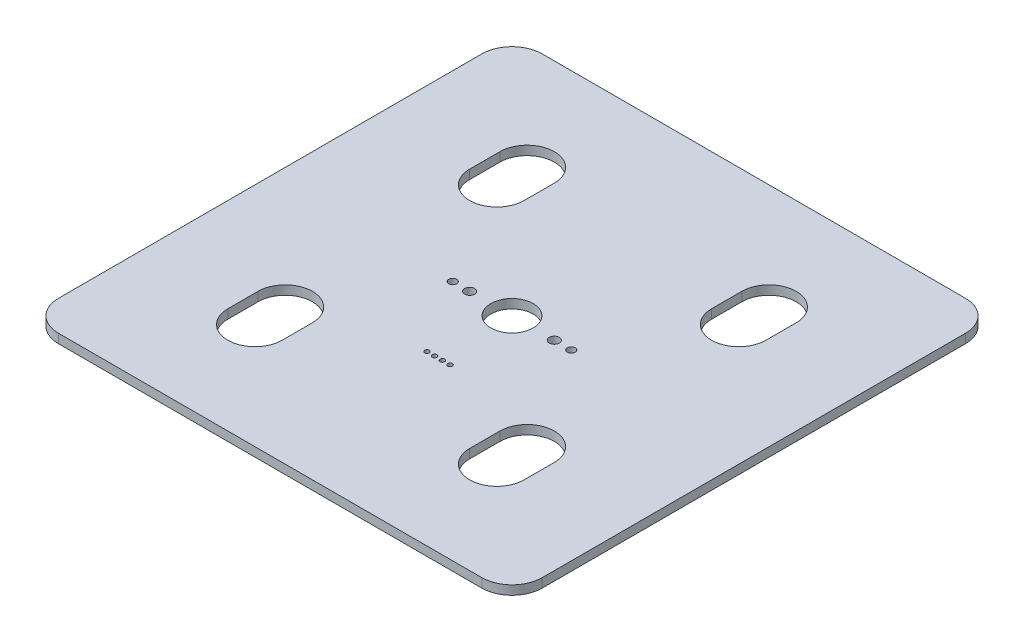
from build123d import *

# Parameters (mm, degrees)
SKETCH1_W               = 80
SKETCH1_H               = 80
BOSS_EXTRUDE1_DEPTH     = 0.75
FILLET1_R               = 5
FILLET3_R               = 5
FILLET4_R               = 5
FILLET5_R               = 5
CUT_EXTRUDE1_DEPTH      = 57.588426379
CUT_EXTRUDE1_DEPTH_BACK = 57.588426379
CUT_EXTRUDE2_DEPTH      = 57.588426379
CUT_EXTRUDE2_DEPTH_BACK = 57.588426379
SKETCH3_R               = 3.5
CUT_EXTRUDE3_DEPTH      = 57.588426379
CUT_EXTRUDE3_DEPTH_BACK = 57.588426379
SKETCH4_R               = 0.38
SKETCH4_R_2             = 0.65
SKETCH4_R_3             = 0.825


with BuildPart() as part:
    # Sketch1 → Boss-Extrude1 (new, symmetric)
    with BuildSketch(Plane(origin=(0, 0, 0), x_dir=(1, 0, 0), z_dir=(0, 1, 0))):
        Rectangle(SKETCH1_W, SKETCH1_H)
    extrude(amount=BOSS_EXTRUDE1_DEPTH, both=True)

    # Fillet1
    fillet1_edges = [part.edges().sort_by_distance(p)[0] for p in [
        (-40, 0, 40),
    ]]
    fillet(fillet1_edges, radius=FILLET1_R)

    # Fillet3
    fillet3_edges = [part.edges().sort_by_distance(p)[0] for p in [
        (-40, 0, -40),
    ]]
    fillet(fillet3_edges, radius=FILLET3_R)

    # Fillet4
    fillet4_edges = [part.edges().sort_by_distance(p)[0] for p in [
        (40, 0, -40),
    ]]
    fillet(fillet4_edges, radius=FILLET4_R)

    # Fillet5
    fillet5_edges = [part.edges().sort_by_distance(p)[0] for p in [
        (40, 0, 40),
    ]]
    fillet(fillet5_edges, radius=FILLET5_R)

    # Sketch2 → Cut-Extrude1 (cut, two sides: drawn at the far end of the back side and taken through both)
    with BuildSketch(Plane(origin=(0, 0.75, 0), x_dir=(1, 0, 0), z_dir=(0, 1, 0)).offset(-CUT_EXTRUDE1_DEPTH_BACK)):
        with BuildLine():
            Line((-24.5, 17.5), (-24.5, 22.5))
            ThreePointArc((-24.5, 22.5), (-20, 27), (-15.5, 22.5))
            Line((-15.5, 22.5), (-15.5, 17.5))
            ThreePointArc((-15.5, 17.5), (-20, 13), (-24.5, 17.5))
        make_face()
        with BuildLine():
            Line((-15.5, -17.5), (-15.5, -22.5))
            ThreePointArc((-15.5, -22.5), (-20, -27), (-24.5, -22.5))
            Line((-24.5, -22.5), (-24.5, -17.5))
            ThreePointArc((-24.5, -17.5), (-20, -13), (-15.5, -17.5))
        make_face()
        with BuildLine():
            Line((15.5, -17.5), (15.5, -22.5))
            ThreePointArc((15.5, -22.5), (20, -27), (24.5, -22.5))
            Line((24.5, -22.5), (24.5, -17.5))
            ThreePointArc((24.5, -17.5), (20, -13), (15.5, -17.5))
        make_face()
        with BuildLine():
            Line((24.5, 17.5), (24.5, 22.5))
            ThreePointArc((24.5, 22.5), (20, 27), (15.5, 22.5))
            Line((15.5, 22.5), (15.5, 17.5))
            ThreePointArc((15.5, 17.5), (20, 13), (24.5, 17.5))
        make_face()
    extrude(amount=CUT_EXTRUDE1_DEPTH + CUT_EXTRUDE1_DEPTH_BACK, mode=Mode.SUBTRACT)

    # Sketch3 → Cut-Extrude2 (cut, two sides: drawn at the far end of the back side and taken through both)
    with BuildSketch(Plane(origin=(0, 0.75, 0), x_dir=(1, 0, 0), z_dir=(0, 1, 0)).offset(-CUT_EXTRUDE2_DEPTH_BACK)):
        with Locations(Location((0, 0, 0), (0, 0, 270))):
            Circle(SKETCH3_R)
    extrude(amount=CUT_EXTRUDE2_DEPTH + CUT_EXTRUDE2_DEPTH_BACK, mode=Mode.SUBTRACT)

    # Sketch4 → Cut-Extrude3 (cut, two sides: drawn at the far end of the back side and taken through both)
    with BuildSketch(Plane(origin=(0, 0.75, 0), x_dir=(1, 0, 0), z_dir=(0, 1, 0)).offset(-CUT_EXTRUDE3_DEPTH_BACK)):
        with Locations(Location((-0.635, -12.15, 0), (0, 0, 270))):
            Circle(SKETCH4_R)
        with Locations(Location((-1.905, -12.15, 0), (0, 0, 270))):
            Circle(SKETCH4_R)
        with Locations(Location((-9.8, 0, 0), (0, 0, 270))):
            Circle(SKETCH4_R_2)
        with Locations(Location((-7, 0, 0), (0, 0, 270))):
            Circle(SKETCH4_R_3)
        with Locations(Location((7, 0, 0), (0, 0, 90))):
            Circle(SKETCH4_R_3)
        with Locations(Location((9.8, 0, 0), (0, 0, 90))):
            Circle(SKETCH4_R_2)
        with Locations(Location((0.635, -12.15, 0), (0, 0, 90))):
            Circle(SKETCH4_R)
        with Locations(Location((1.905, -12.15, 0), (0, 0, 90))):
            Circle(SKETCH4_R)
    extrude(amount=CUT_EXTRUDE3_DEPTH + CUT_EXTRUDE3_DEPTH_BACK, mode=Mode.SUBTRACT)


solid = part.part
